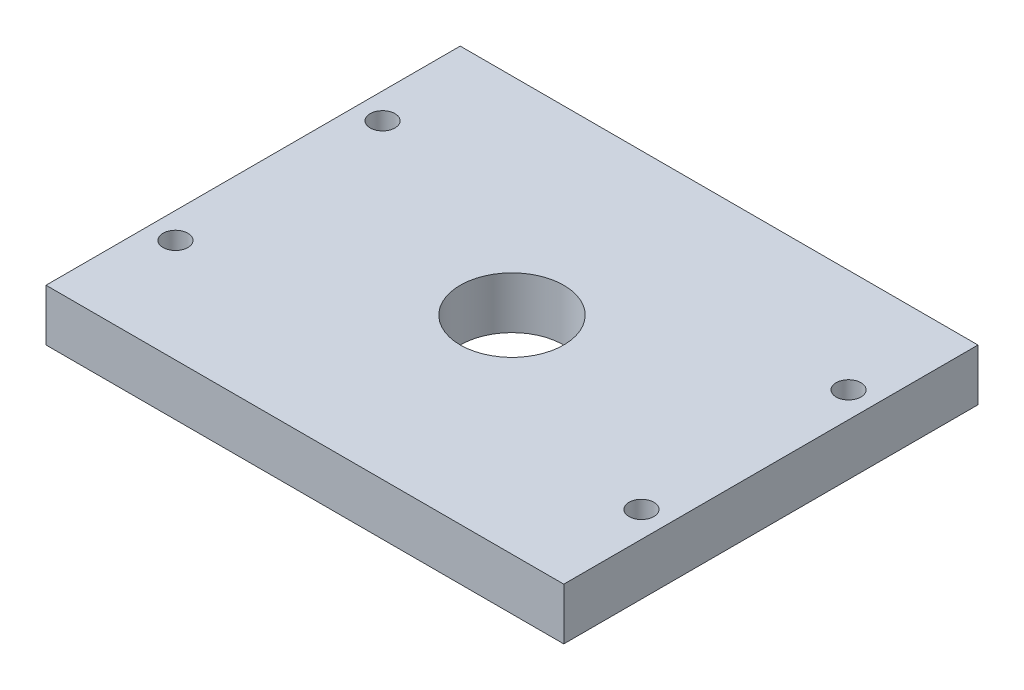
from build123d import *

# Parameters (mm, degrees)
SKETCH1_W                                           = 50
SKETCH1_H                                           = 40
SKETCH1_R                                           = 5
BOSS_EXTRUDE1_DEPTH                                 = 5
CSK_FOR_M2_COUNTERSUNK_FLAT_HEAD_SCREW1_D           = 2.4
CSK_FOR_M2_COUNTERSUNK_FLAT_HEAD_SCREW1_CSINK_D     = 4.4
CSK_FOR_M2_COUNTERSUNK_FLAT_HEAD_SCREW1_CSINK_ANGLE = 90


with BuildPart() as part:
    # Sketch1 → Boss-Extrude1 (new body)
    with BuildSketch(Plane(origin=(0, 0, 0), x_dir=(1, 0, 0), z_dir=(0, 1, 0))):
        Rectangle(SKETCH1_W, SKETCH1_H)
        with Locations(Location((0, 0, 0), (0, 0, 270))):
            Circle(SKETCH1_R, mode=Mode.SUBTRACT)
    extrude(amount=BOSS_EXTRUDE1_DEPTH)

    # CSK for M2 Countersunk Flat Head Screw1 (through all)
    with Locations(Plane(origin=(0, 0, 0), x_dir=(-1, 0, 0), z_dir=(0, -1, 0))):
        with Locations((22.5, -10), (22.5, 10), (-22.5, 10), (-22.5, -10)):
            CounterSinkHole(CSK_FOR_M2_COUNTERSUNK_FLAT_HEAD_SCREW1_D / 2, CSK_FOR_M2_COUNTERSUNK_FLAT_HEAD_SCREW1_CSINK_D / 2, counter_sink_angle=CSK_FOR_M2_COUNTERSUNK_FLAT_HEAD_SCREW1_CSINK_ANGLE)


solid = part.part
